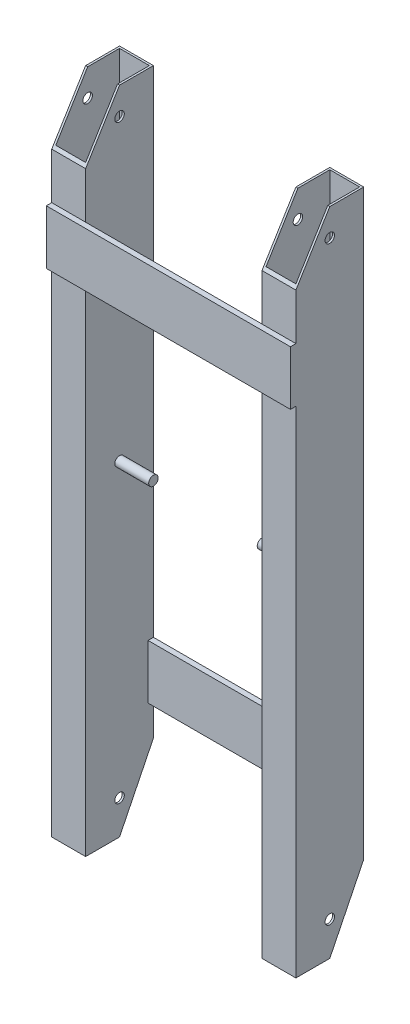
from build123d import *

# Parameters (mm, degrees)
SKETCH1_W               = 25
SKETCH1_H               = 480
BOSS_EXTRUDE1_DEPTH     = 50
BOSS_EXTRUDE1_2_DEPTH   = 50
SHELL1_T                = -1.5
SHELL2_T                = -1.5
SKETCH2_W               = 180
SKETCH2_H               = 40
BOSS_EXTRUDE2_DEPTH     = 4
SKETCH3_W               = 180
SKETCH3_H               = 40
BOSS_EXTRUDE3_DEPTH     = 4
CUT_EXTRUDE1_DEPTH      = 1306.595649503
CUT_EXTRUDE1_DEPTH_BACK = 1306.595649503
SKETCH4_R               = 3.5
SKETCH5_R               = 3.5
BOSS_EXTRUDE4_DEPTH     = 25
BOSS_EXTRUDE5_START     = 25
SKETCH6_R               = 3.5
BOSS_EXTRUDE5_DEPTH     = 25
CUT_EXTRUDE6_DEPTH      = 1306.595649503
CUT_EXTRUDE6_DEPTH_BACK = 1306.595649503
CUT_EXTRUDE7_DEPTH      = 1306.595649503
CUT_EXTRUDE7_DEPTH_BACK = 1306.595649503


with BuildPart() as part:
    # Sketch1 → Boss-Extrude1 (new body)
    with BuildSketch(Plane.XY):
        with Locations((-160.684832451, -1052)):
            Rectangle(SKETCH1_W, SKETCH1_H)
    extrude(amount=BOSS_EXTRUDE1_DEPTH)

    # Shell2
    shell2_openings = [part.faces().sort_by_distance(p)[0] for p in [
        (-160.684832451, -1292, 25),
        (-160.684832451, -812, 25),
    ]]
    offset(amount=SHELL2_T, openings=shell2_openings, kind=Kind.INTERSECTION)



with BuildPart() as body_2:
    # Sketch1 → Boss-Extrude1 2 (new body)
    with BuildSketch(Plane.XY):
        with Locations((-315.684832451, -1052)):
            Rectangle(SKETCH1_W, SKETCH1_H)
    extrude(amount=BOSS_EXTRUDE1_2_DEPTH)

    # Shell1
    shell1_openings = [body_2.faces().sort_by_distance(p)[0] for p in [
        (-315.684832451, -812, 25),
        (-315.684832451, -1292, 25),
    ]]
    offset(amount=SHELL1_T, openings=shell1_openings, kind=Kind.INTERSECTION)


with BuildPart() as part_1:
    add(part.part)

    add(body_2.part)  # Boss-Extrude2 merges body 2
    # Sketch2 → Boss-Extrude2 (add)
    with BuildSketch(Plane.XY):
        with Locations((-238.184832451, -1197)):
            Rectangle(SKETCH2_W, SKETCH2_H)
    extrude(amount=BOSS_EXTRUDE2_DEPTH)

    # Sketch3 → Boss-Extrude3 (add)
    with BuildSketch(Plane.XY.offset(50)):
        with Locations((-238.184832451, -907)):
            Rectangle(SKETCH3_W, SKETCH3_H)
    extrude(amount=BOSS_EXTRUDE3_DEPTH)

    # Sketch4 → Cut-Extrude1 (cut, two sides: drawn at the far end of the back side and taken through both)
    with BuildSketch(Plane.ZY.offset(328.184832451).offset(-CUT_EXTRUDE1_DEPTH_BACK)):
        with Locations((25, -1267)):
            Circle(SKETCH4_R)
        with Locations((25, -832)):
            Circle(SKETCH4_R)
    extrude(amount=CUT_EXTRUDE1_DEPTH + CUT_EXTRUDE1_DEPTH_BACK, mode=Mode.SUBTRACT)

    # Sketch5 → Boss-Extrude4 (add)
    with BuildSketch(Plane(origin=(-303.184832451, 0, 0), x_dir=(0, 0, -1), z_dir=(1, 0, 0))):
        with Locations(Location((-25, -1052, 0), (0, 0, 270))):
            Circle(SKETCH5_R)
    extrude(amount=BOSS_EXTRUDE4_DEPTH)

    # Sketch6 → Boss-Extrude5 (add)
    with BuildSketch(Plane.ZY.offset(173.184832451).offset(BOSS_EXTRUDE5_START)):
        with Locations(Location((25, -1052, 0), (0, 0, 270))):
            Circle(SKETCH6_R)
    extrude(amount=-BOSS_EXTRUDE5_DEPTH)

    # Sketch11 → Cut-Extrude6 (cut, two sides: drawn at the far end of the back side and taken through both)
    with BuildSketch(Plane.ZY.offset(328.184832451).offset(-CUT_EXTRUDE6_DEPTH_BACK)):
        Polygon((25, -812), (50, -852.824757881), (50, -812), align=None)
    extrude(amount=CUT_EXTRUDE6_DEPTH + CUT_EXTRUDE6_DEPTH_BACK, mode=Mode.SUBTRACT)

    # Sketch12 → Cut-Extrude7 (cut, two sides: drawn at the far end of the back side and taken through both)
    with BuildSketch(Plane.ZY.offset(328.184832451).offset(-CUT_EXTRUDE7_DEPTH_BACK)):
        Polygon((25, -1292), (0, -1241.284902425), (0, -1292), align=None)
    extrude(amount=CUT_EXTRUDE7_DEPTH + CUT_EXTRUDE7_DEPTH_BACK, mode=Mode.SUBTRACT)


solid = part_1.part
